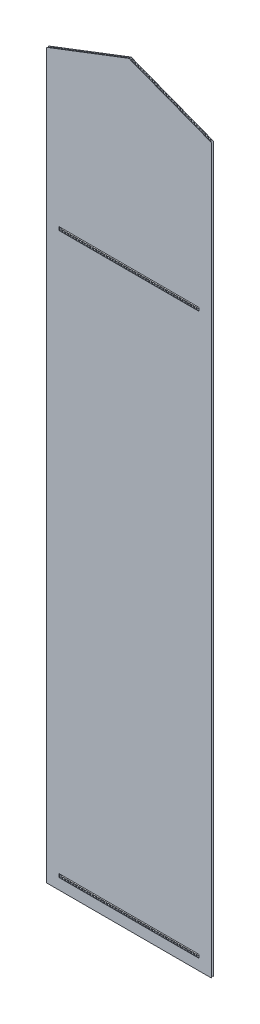
from build123d import *

# Parameters (mm, degrees)
BOSS_EXTRUDE1_DEPTH = 2695.8
LPATTERN1_COUNT     = 59
LPATTERN1_PITCH     = 10
SKETCH2_W           = 500.2
SKETCH2_H           = 12.1
CUT_EXTRUDE1_DEPTH  = 2759.55517255
LPATTERN2_COUNT     = 2
LPATTERN2_PITCH     = 2000


with BuildPart() as part:
    # Sketch1 → Boss-Extrude1 (new body)
    with BuildSketch(Plane(origin=(0, 0, 0), x_dir=(1, 0, 0), z_dir=(0, 1, 0))):
        Polygon((5, -4), (-5.3, -4), (-5.3, -3.7), (4.7, -3.7), (4.7, 3.7), (-5.3, 3.7), (-5.3, 4), (5, 4), align=None)
    boss_extrude1 = extrude(amount=BOSS_EXTRUDE1_DEPTH)

    # LPattern1: Boss-Extrude1 ×59
    with Locations(*[(i * LPATTERN1_PITCH, 0, 0) for i in range(1, LPATTERN1_COUNT)]):
        add(boss_extrude1)

    # Sketch2 → Cut-Extrude1 (cut, through all)
    with BuildSketch(Plane.XY.offset(4)):
        with Locations((289.85, 44.95)):
            Rectangle(SKETCH2_W, SKETCH2_H)
        Polygon((585, 0), (583, 0), (583, 2582.886394094), (288.85, 2695.8), (-5.3, 2582.886394094), (-5.3, 2695.8), (-5.3, 2705.647286104), (585.015296686, 2705.647286104), (585, 2695.8), align=None)
    cut_extrude1 = extrude(amount=-CUT_EXTRUDE1_DEPTH, mode=Mode.SUBTRACT)

    # LPattern2: Cut-Extrude1 ×2
    with Locations(*[(0, i * LPATTERN2_PITCH, 0) for i in range(1, LPATTERN2_COUNT)]):
        add(cut_extrude1, mode=Mode.SUBTRACT)


solid = part.part
